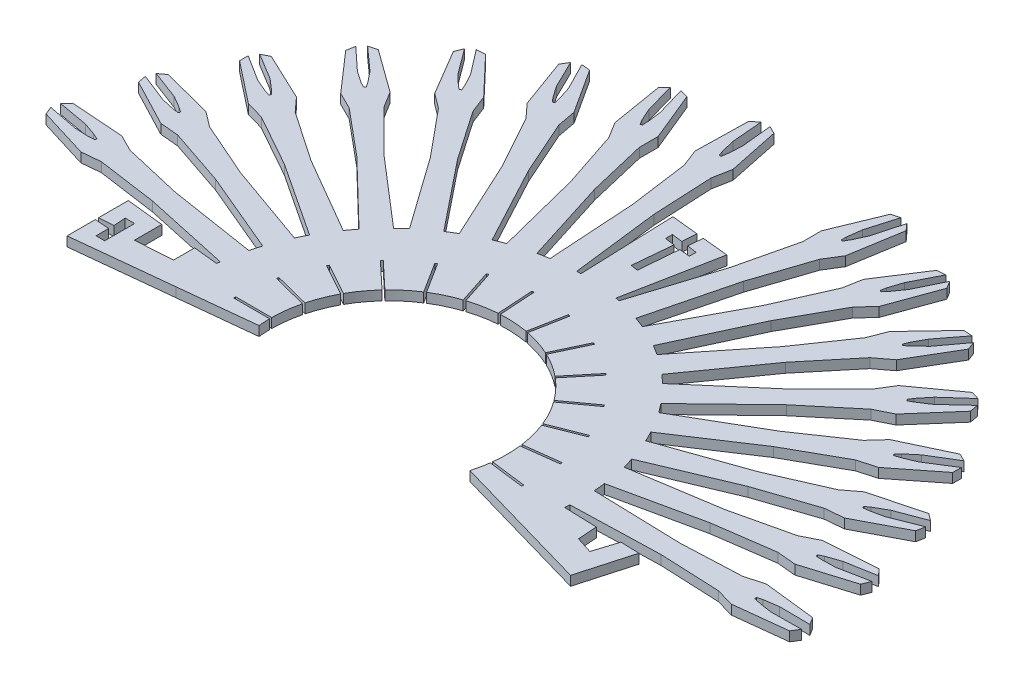
from build123d import *

# Parameters (mm, degrees)
SKETCH2_R               = 6.200163369
BOSS_EXTRUDE1_DEPTH     = 0.5
BOSS_EXTRUDE2_DEPTH     = 0.5
BOSS_EXTRUDE3_DEPTH     = 0.5
CIRPATTERN1_COUNT       = 18
CIRPATTERN1_ANGLE       = 180
CUT_EXTRUDE4_DEPTH      = 103.85147563
CUT_EXTRUDE4_DEPTH_BACK = 0.5
CUT_EXTRUDE6_DEPTH      = 103.85147563
CUT_EXTRUDE6_DEPTH_BACK = 0.5
CUT_EXTRUDE13_DEPTH     = 10
SKETCH13_R              = 2.29112386
SKETCH13_W              = 5.561420579
SKETCH13_H              = 0.106651934
CUT_EXTRUDE14_DEPTH     = 103.85147563


with BuildPart() as part:
    # Sketch2 → Boss-Extrude1 (new body)
    with BuildSketch(Plane(origin=(0, 0, 0), x_dir=(1, 0, 0), z_dir=(0, 1, 0))):
        with BuildLine():
            Line((41.736564116, 50.95828476), (36.555246465, 51.501399508))
            Line((36.555246465, 51.501399508), (36.555246465, 48.286890075))
            Line((36.555246465, 48.286890075), (41.732722408, 48.833722572))
            ThreePointArc((41.732722408, 48.833722572), (41.733244647, 48.828783324), (41.733769301, 48.82384433))
            ThreePointArc((41.733769301, 48.82384433), (50.963390645, 39.773597615), (61.612393233, 47.101054176))
            Line((61.612393233, 47.101054176), (66.500703475, 45.70083261))
            Line((66.500703475, 45.70083261), (67.011967053, 48.840095645))
            Line((67.011967053, 48.840095645), (61.960868148, 49.001189769))
            ThreePointArc((61.960868148, 49.001189769), (59.963353335, 56.003029367), (53.794021492, 59.87022057))
            Line((53.794021492, 59.87022057), (54.740102943, 64.742398272))
            Line((54.740102943, 64.742398272), (51.585987879, 65.064191003))
            Line((51.585987879, 65.064191003), (51.764987526, 60.059419928))
            ThreePointArc((51.764987526, 60.059419928), (45.016500937, 57.426340658), (41.737479755, 50.966991019))
            ThreePointArc((41.737479755, 50.966991019), (41.737020998, 50.962637988), (41.736564116, 50.95828476))
        make_face()
        with Locations((51.841, 49.9)):
            Circle(SKETCH2_R, mode=Mode.SUBTRACT)
    extrude(amount=BOSS_EXTRUDE1_DEPTH)

    # Sketch3 → Boss-Extrude2 (add)
    with BuildSketch(Plane(origin=(0, 0, 0), x_dir=(1, 0, 0), z_dir=(0, 1, 0))):
        Polygon((32.227287846, 50.031148161), (31.574301661, 50.133558432), (29.95584718, 50.120457409), (30.19673075, 50.505107439), (32.947654716, 50.817304866), (33.894871846, 50.546841292), (37.047721796, 50.407771903), (41.857469478, 50.546841292), (41.857469478, 49.253158708), (37.047721796, 49.392228097), (33.894871846, 49.253158708), (32.947654716, 48.982695134), (30.19673075, 49.294892561), (29.95584718, 49.679542591), (31.574301661, 49.666441568), (32.323022544, 49.778206625), (32.588103044, 49.852616566), (32.588103044, 49.947383434), align=None)
    boss_extrude2 = extrude(amount=BOSS_EXTRUDE2_DEPTH)

    # CirPattern1: Boss-Extrude2 ×18 about axis
    cirpattern1_axis = Axis((51.841, 0.5, -49.9), (0, -1, 0))
    for i in range(1, CIRPATTERN1_COUNT):
        add(boss_extrude2.rotate(cirpattern1_axis, i * CIRPATTERN1_ANGLE / (CIRPATTERN1_COUNT - 1)))

    # Sketch8 → Cut-Extrude4 (cut, two sides: drawn at the far end of the back side and taken through both)
    with BuildSketch(Plane(origin=(0, 0, 0), x_dir=(1, 0, 0), z_dir=(0, 1, 0)).offset(-CUT_EXTRUDE4_DEPTH_BACK)):
        Polygon((36.555246465, 48.286890075), (27.995570216, 47.169676763), (27.995570216, 52.890741223), (36.555246465, 51.501399508), (36.555246465, 48.753981284), align=None)
        Polygon((51.655565612, 72.526598057), (51.585987879, 65.064191003), (54.740102943, 64.742398272), (56.406958129, 72.526598057), align=None)
        Polygon((47.95502979, 51.501399508), (46.998338953, 48.798), (52.839188276, 46.161429513), (54.740102943, 51.719098387), align=None)
    extrude(amount=CUT_EXTRUDE4_DEPTH + CUT_EXTRUDE4_DEPTH_BACK, mode=Mode.SUBTRACT)


with BuildPart() as body_2:
    # Sketch5 → Boss-Extrude3 (new body)
    with BuildSketch(Plane(origin=(0, 0, 0), x_dir=(1, 0, 0), z_dir=(0, 1, 0))):
        Polygon((51.841, 49.9), (51.841, 47.98601508), (47.518666367, 49.9), align=None)
    extrude(amount=BOSS_EXTRUDE3_DEPTH)


with BuildPart() as cut_extrude6_tool:
    # Sketch9 → Cut-Extrude6 (new, two sides: drawn at the far end of the back side and taken through both)
    with BuildSketch(Plane(origin=(0, 0, 0), x_dir=(1, 0, 0), z_dir=(0, 1, 0)).offset(-CUT_EXTRUDE6_DEPTH_BACK)):
        Polygon((36.555246465, 48.286890075), (47.009139853, 49.390092422), (47.587964148, 50.49093808), (51.841, 49.9), (66.500703475, 45.70083261), (51.841, 34.857894493), align=None)
    extrude(amount=CUT_EXTRUDE6_DEPTH + CUT_EXTRUDE6_DEPTH_BACK)


with BuildPart() as part_1:
    add(part.part)

    # Cut-Extrude6: cut by cut_extrude6_tool
    add(cut_extrude6_tool.part, mode=Mode.SUBTRACT)

    # Sketch12 → Cut-Extrude13 (cut)
    with BuildSketch(Plane(origin=(0, 0, 0), x_dir=(1, 0, 0), z_dir=(0, 1, 0))):
        Polygon((36.555246465, 51.501399508), (38.519898032, 51.501399508), (38.519898032, 49.855912942), (40.450129226, 49.985069668), (40.450129226, 51.16915959), (38.068460195, 51.729226348), align=None)
        Polygon((66.036768105, 49.006664529), (65.095153252, 45.671159721), (66.958125451, 45.145241638), (67.462296373, 48.891444034), align=None)
        Polygon((53.08254989, 66.12808357), (52.948117152, 64.171821775), (52.385771098, 64.24300482), (52.385771098, 63.878888302), (52.896048123, 63.814296274), (52.708350835, 61.754583122), (53.087715457, 61.700660527), (53.262410471, 63.755183921), (53.814395603, 63.698049757), (53.814395603, 64.054600552), (53.300329713, 64.12534266), (53.473842648, 66.014949594), align=None)
        Polygon((65.024787978, 48.903472521), (64.630204445, 47.660868166), (63.761063297, 47.936860104), (63.677982038, 49.064928372), (65.504842158, 49.006664529), align=None)
        Polygon((35.431152546, 49.858633501), (37.312510157, 49.997193872), (37.266298078, 50.624656446), (37.766087028, 50.624656446), (37.766087028, 49.051172586), (37.312510157, 49.051172586), (37.312510157, 49.715786798), align=None)
    extrude(amount=CUT_EXTRUDE13_DEPTH, mode=Mode.SUBTRACT)

    # Sketch13 → Cut-Extrude14 (cut, through all)
    with BuildSketch(Plane(origin=(0, 0, 0), x_dir=(1, 0, 0), z_dir=(0, 1, 0))):
        with Locations((51.841102424, 49.89933139)):
            Circle(SKETCH13_R)
        Polygon((49.373582939, 50.469956344), (43.986884615, 51.853025401), (44.013407872, 51.956326668), (49.400106197, 50.573257612), align=None)
        with Locations((46.528485657, 49.891707937)):
            Rectangle(SKETCH13_W, SKETCH13_H)
        Polygon((49.593013257, 51.065676254), (44.719503253, 53.744911051), (44.770883214, 53.838370853), (49.644393218, 51.159136056), align=None)
        Polygon((49.953699285, 51.588110427), (45.899598159, 55.395164789), (45.972606432, 55.472910703), (50.026707557, 51.665856341), align=None)
        Polygon((50.432977793, 52.004432402), (47.453019629, 56.700095102), (47.543068835, 56.757242065), (50.523026999, 52.061579366), align=None)
        Polygon((51.000733951, 52.288483138), (49.282160479, 57.577708419), (49.383592496, 57.610665679), (51.102165967, 52.321440398), align=None)
        Polygon((51.62129355, 52.422414683), (51.272089063, 57.972861068), (51.378530543, 57.979557799), (51.727735031, 52.429111413), align=None)
        Polygon((52.255664549, 52.397811626), (53.297770848, 57.860724156), (53.402533683, 57.840739576), (52.360427384, 52.377827046), align=None)
        Polygon((52.863987086, 52.216219866), (55.2319248, 57.248343656), (55.328426355, 57.202933471), (52.960488641, 52.170809682), align=None)
        Polygon((53.408038017, 51.889049483), (56.953020911, 56.174197688), (57.035197638, 56.106215186), (53.490214744, 51.821066982), align=None)
        Polygon((53.853632622, 51.436857795), (58.352916383, 54.705778792), (58.415604817, 54.619495565), (53.916321056, 51.350574568), align=None)
        Polygon((54.172772553, 50.888057667), (59.343650635, 52.93535313), (59.382911831, 52.83619067), (54.212033749, 50.788895207), align=None)
        Polygon((54.345405075, 50.277132232), (59.862972191, 50.974163056), (59.876339223, 50.868352105), (54.358772106, 50.17132128), align=None)
        Polygon((54.36068305, 49.64246818), (59.878250167, 48.945437356), (59.864883135, 48.839626404), (54.347316019, 49.536657228), align=None)
        Polygon((54.217646509, 49.023943788), (59.388524591, 46.976648325), (59.349263396, 46.877485865), (54.178385314, 48.924781328), align=None)
        Polygon((53.925282963, 48.460423219), (58.424566723, 45.191502221), (58.36187829, 45.105218994), (53.862594529, 48.374139992), align=None)
        Polygon((53.501962688, 47.987314542), (57.046945581, 43.702166338), (56.964768854, 43.634183836), (53.41978596, 47.919332041), align=None)
        Polygon((52.974284454, 47.634344916), (55.342222168, 42.602221126), (55.245720613, 42.556810941), (52.877782899, 47.588934731), align=None)
        Polygon((52.375404226, 47.423692719), (53.417510525, 41.960780189), (53.31274769, 41.94079561), (52.270641391, 47.40370814), align=None)
        Polygon((51.742951851, 47.368594006), (51.393747363, 41.81814762), (51.287305883, 41.824844351), (51.63651037, 47.375290736), align=None)
        Polygon((51.116666637, 47.472510829), (49.398093165, 42.183285548), (49.296661149, 42.216242808), (51.01523462, 47.505468089), align=None)
        Polygon((50.535900388, 47.728913714), (47.555942224, 43.033251014), (47.465893018, 43.090397978), (50.445851182, 47.786060678), align=None)
        Polygon((50.037144783, 48.121691923), (45.983043657, 44.314637561), (45.910035385, 44.392383475), (49.96413651, 48.199437837), align=None)
        Polygon((49.651738471, 48.626165758), (44.778228467, 45.946930961), (44.726848506, 46.040390763), (49.60035851, 48.71962556), align=None)
        Polygon((49.403897948, 49.210637272), (44.017199624, 47.827568216), (43.990676366, 47.930869483), (49.377374691, 49.313938539), align=None)
    extrude(amount=CUT_EXTRUDE14_DEPTH, mode=Mode.SUBTRACT)


with BuildPart() as body_2_1:
    add(body_2.part)

    # Cut-Extrude6: cut by cut_extrude6_tool
    add(cut_extrude6_tool.part, mode=Mode.SUBTRACT)


solid = part_1.part
